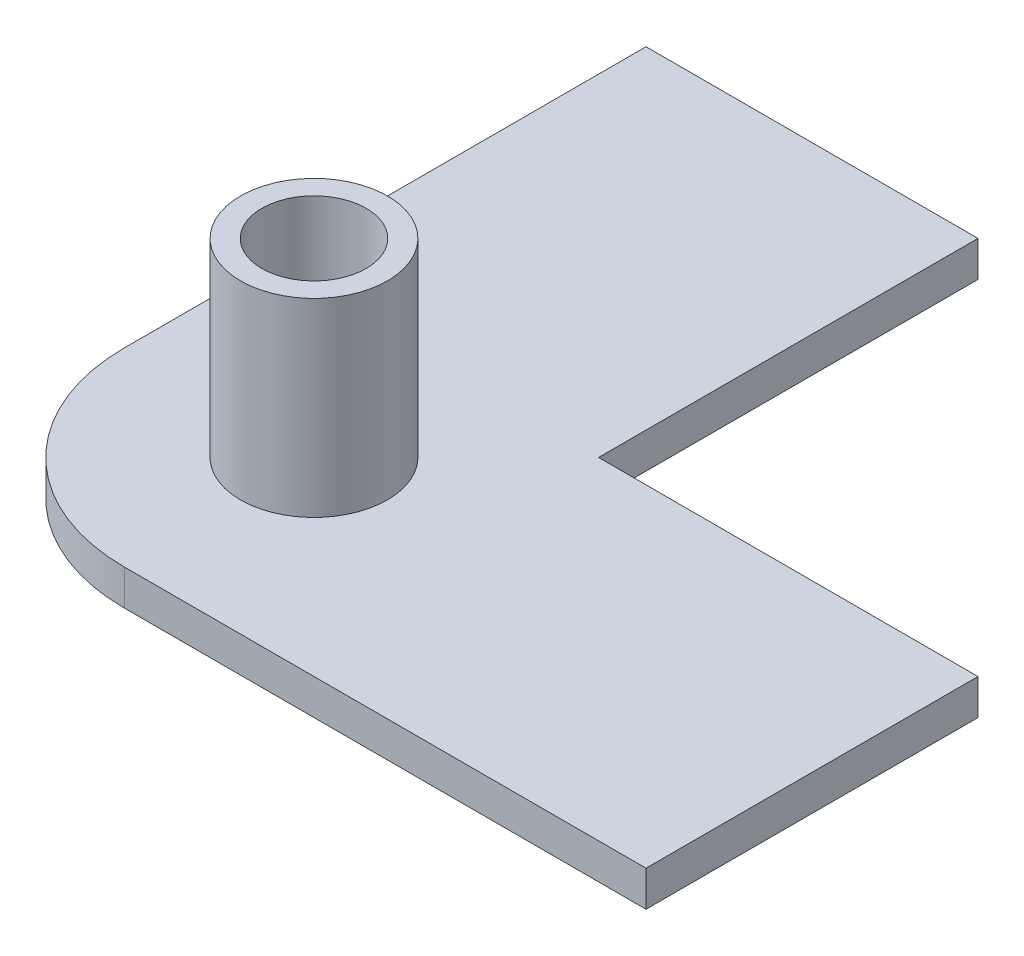
from build123d import *

# Parameters (mm, degrees)
SKETCH1_R           = 1.1
BOSS_EXTRUDE1_DEPTH = 0.75
SKETCH2_R           = 1.55
SKETCH2_R_2         = 1.1
BOSS_EXTRUDE2_DEPTH = 4


with BuildPart() as part:
    # Sketch1 → Boss-Extrude1 (new body)
    with BuildSketch(Plane(origin=(0, 0, 0), x_dir=(1, 0, 0), z_dir=(0, 1, 0))):
        with BuildLine():
            Line((11, -3.99967418), (11, 3))
            Line((11, 3), (3, 3))
            Line((3, 3), (3, 11))
            Line((3, 11), (-3.99967418, 11))
            Line((-3.99967418, 11), (-3.99967418, 0))
            ThreePointArc((-3.99967418, 0), (-2.828196736, -2.828196736), (0, -3.99967418))
            Line((0, -3.99967418), (11, -3.99967418))
        make_face()
        with Locations(Location((0, 0, 0), (0, 0, 270))):
            Circle(SKETCH1_R, mode=Mode.SUBTRACT)
    extrude(amount=BOSS_EXTRUDE1_DEPTH)

    # Sketch2 → Boss-Extrude2 (add)
    with BuildSketch(Plane(origin=(0, 0.75, 0), x_dir=(1, 0, 0), z_dir=(0, 1, 0))):
        with Locations(Location((0, 0, 0), (0, 0, 270))):
            Circle(SKETCH2_R)
        with Locations(Location((0, 0, 0), (0, 0, 270))):
            Circle(SKETCH2_R_2, mode=Mode.SUBTRACT)
    extrude(amount=BOSS_EXTRUDE2_DEPTH)


solid = part.part
